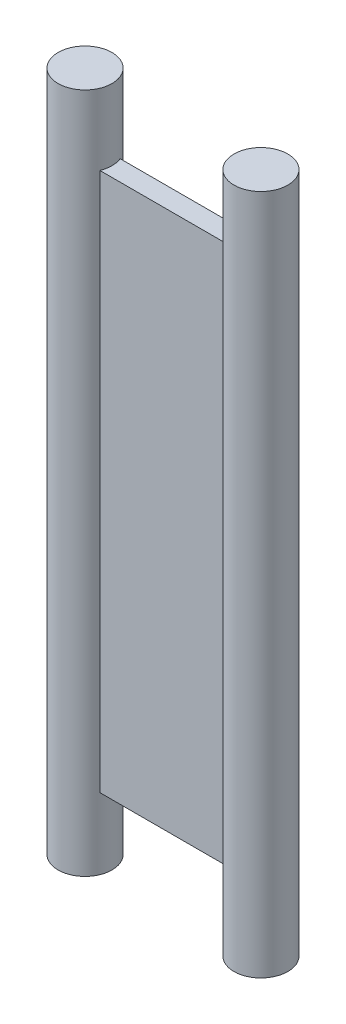
from build123d import *

# Parameters (mm, degrees)
SKETCH1_W           = 8.65
SKETCH1_H           = 1
BOSS_EXTRUDE1_DEPTH = 26.5
SKETCH2_R           = 1.325
BOSS_EXTRUDE2_DEPTH = 16.75


with BuildPart() as part:
    # Sketch1 → Boss-Extrude1 (new body)
    with BuildSketch(Plane(origin=(0, 0, 0), x_dir=(1, 0, 0), z_dir=(0, 1, 0))):
        Rectangle(SKETCH1_W, SKETCH1_H)
    extrude(amount=BOSS_EXTRUDE1_DEPTH)

    # Sketch2 → Boss-Extrude2 (add, symmetric)
    with BuildSketch(Plane(origin=(0, 13.25, 0), x_dir=(1, 0, 0), z_dir=(0, 1, 0))):
        with Locations(Location((-4.325, 0, 0), (0, 0, 270))):
            Circle(SKETCH2_R)
        with Locations(Location((4.325, 0, 0), (0, 0, 270))):
            Circle(SKETCH2_R)
    extrude(amount=BOSS_EXTRUDE2_DEPTH, both=True)


solid = part.part
